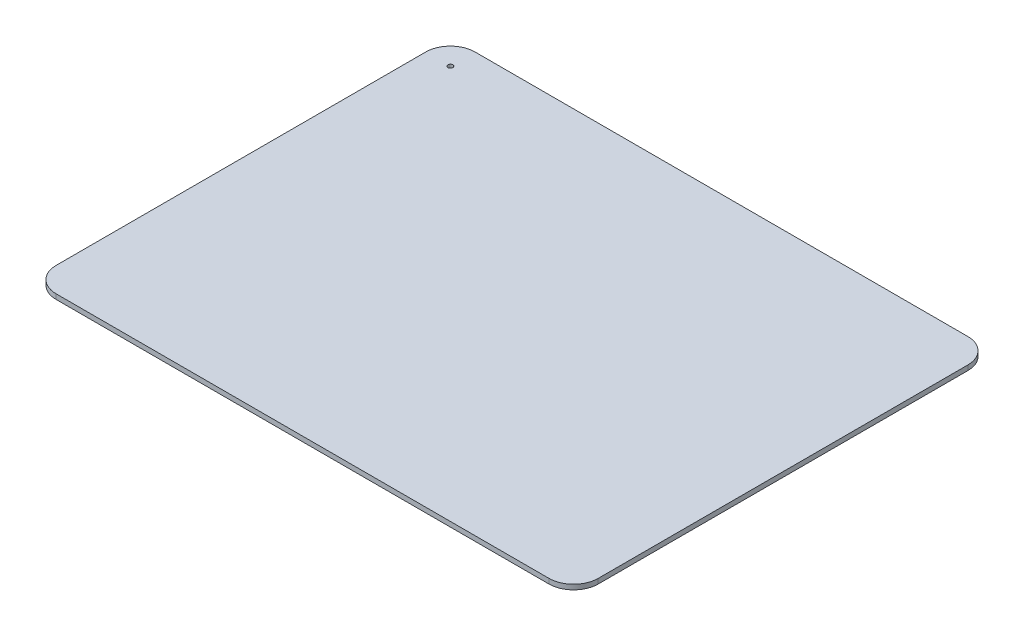
from build123d import *

# Parameters (mm, degrees)
BOSS_EXTRUDE1_DEPTH = 10
SKETCH2_R           = 5
CUT_EXTRUDE1_DEPTH  = 50


with BuildPart() as part:
    # Sketch1 → Boss-Extrude1 (new body)
    with BuildSketch(Plane(origin=(0, 0, 0), x_dir=(1, 0, 0), z_dir=(0, 1, 0))):
        with BuildLine():
            Line((-500, -425), (500, -425))
            ThreePointArc((500, -425), (535.355339059, -410.355339059), (550, -375))
            Line((550, -375), (550, 375))
            ThreePointArc((550, 375), (535.355339059, 410.355339059), (500, 425))
            Line((500, 425), (-500, 425))
            ThreePointArc((-500, 425), (-535.355339059, 410.355339059), (-550, 375))
            Line((-550, 375), (-550, -375))
            ThreePointArc((-550, -375), (-535.355339059, -410.355339059), (-500, -425))
        make_face()
    extrude(amount=BOSS_EXTRUDE1_DEPTH)

    # Sketch2 → Cut-Extrude1 (cut)
    with BuildSketch(Plane(origin=(0, 10, 0), x_dir=(1, 0, 0), z_dir=(0, 1, 0))):
        with Locations(Location((-500, 375, 0), (0, 0, 270))):
            Circle(SKETCH2_R)
    extrude(amount=-CUT_EXTRUDE1_DEPTH, mode=Mode.SUBTRACT)


solid = part.part
